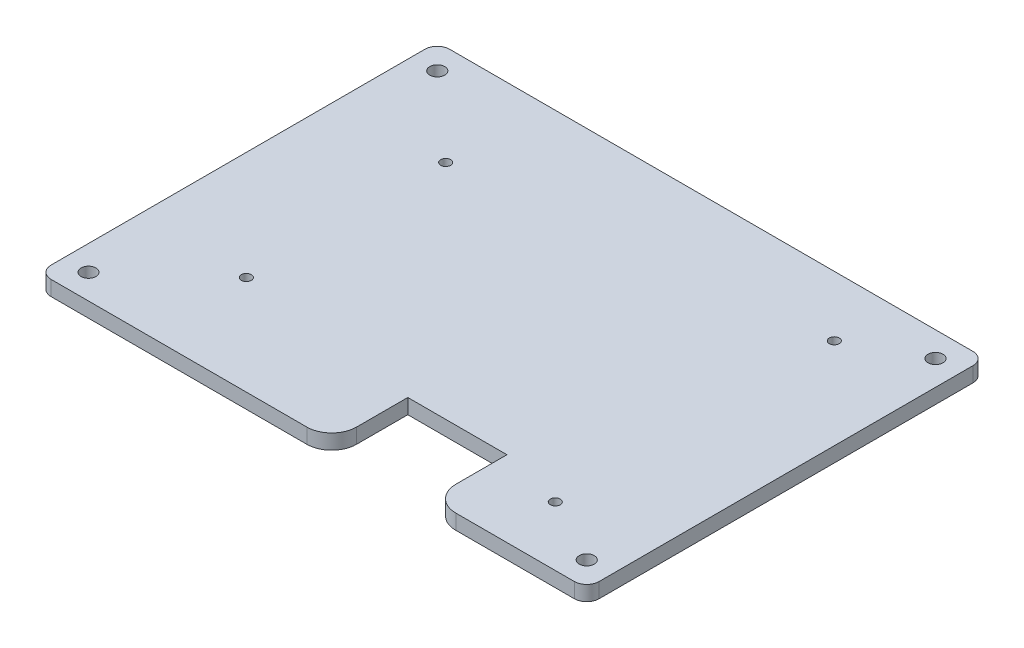
from build123d import *

# Parameters (mm, degrees)
SKETCH5_W           = 110
SKETCH5_H           = 80
SKETCH5_R           = 1
BOSS_EXTRUDE1_DEPTH = 3
SKETCH6_R           = 1.5
CUT_EXTRUDE1_DEPTH  = 137.047785723
FILLET1_R           = 2.5
CUT_EXTRUDE2_DEPTH  = 6
FILLET2_R           = 5


with BuildPart() as part:
    # Sketch5 → Boss-Extrude1 (new body)
    with BuildSketch(Plane(origin=(0, 0, 0), x_dir=(1, 0, 0), z_dir=(0, 1, 0))):
        with Locations((55, 40)):
            Rectangle(SKETCH5_W, SKETCH5_H)
        with Locations(Location((91.764887736, 67.92075713, 0), (0, 0, 270))):
            Circle(SKETCH5_R, mode=Mode.SUBTRACT)
        with Locations(Location((21.764888364, 59.920762627, 0), (0, 0, 270))):
            Circle(SKETCH5_R, mode=Mode.SUBTRACT)
        with Locations(Location((21.764888364, 19.920762627, 0), (0, 0, 270))):
            Circle(SKETCH5_R, mode=Mode.SUBTRACT)
        with Locations(Location((91.764887736, 11.92075713, 0), (0, 0, 270))):
            Circle(SKETCH5_R, mode=Mode.SUBTRACT)
    extrude(amount=BOSS_EXTRUDE1_DEPTH)

    # Sketch6 → Cut-Extrude1 (cut, through all)
    with BuildSketch(Plane(origin=(0, 3, 0), x_dir=(1, 0, 0), z_dir=(0, 1, 0))):
        with Locations(Location((5, 75, 0), (0, 0, 270))):
            Circle(SKETCH6_R)
        with Locations(Location((105, 75, 0), (0, 0, 270))):
            Circle(SKETCH6_R)
        with Locations(Location((105, 5, 0), (0, 0, 270))):
            Circle(SKETCH6_R)
        with Locations(Location((5, 5, 0), (0, 0, 270))):
            Circle(SKETCH6_R)
    extrude(amount=-CUT_EXTRUDE1_DEPTH, mode=Mode.SUBTRACT)

    # Fillet1
    fillet1_edges = [part.edges().sort_by_distance(p)[0] for p in [
        (0, 1.5, -80),
        (110, 1.5, -80),
        (110, 1.5, 0),
        (0, 1.5, 0),
    ]]
    fillet(fillet1_edges, radius=FILLET1_R)

    # Sketch7 → Cut-Extrude2 (cut)
    with BuildSketch(Plane(origin=(0, 3, 0), x_dir=(1, 0, 0), z_dir=(0, 1, 0))):
        Polygon((78.714883487, -234.464098532), (78.714883487, 0), (78.714883487, 15.270760033), (58.814883708, 15.270760033), (58.814883708, 0), (58.814883708, -234.464098532), (58.814883708, -703.392295596), (78.714883487, -703.392295596), align=None)
    extrude(amount=-CUT_EXTRUDE2_DEPTH, mode=Mode.SUBTRACT)

    # Fillet2
    fillet2_edges = [part.edges().sort_by_distance(p)[0] for p in [
        (78.714883487, 1.5, 0),
        (58.814883708, 1.5, 0),
    ]]
    fillet(fillet2_edges, radius=FILLET2_R)


solid = part.part
